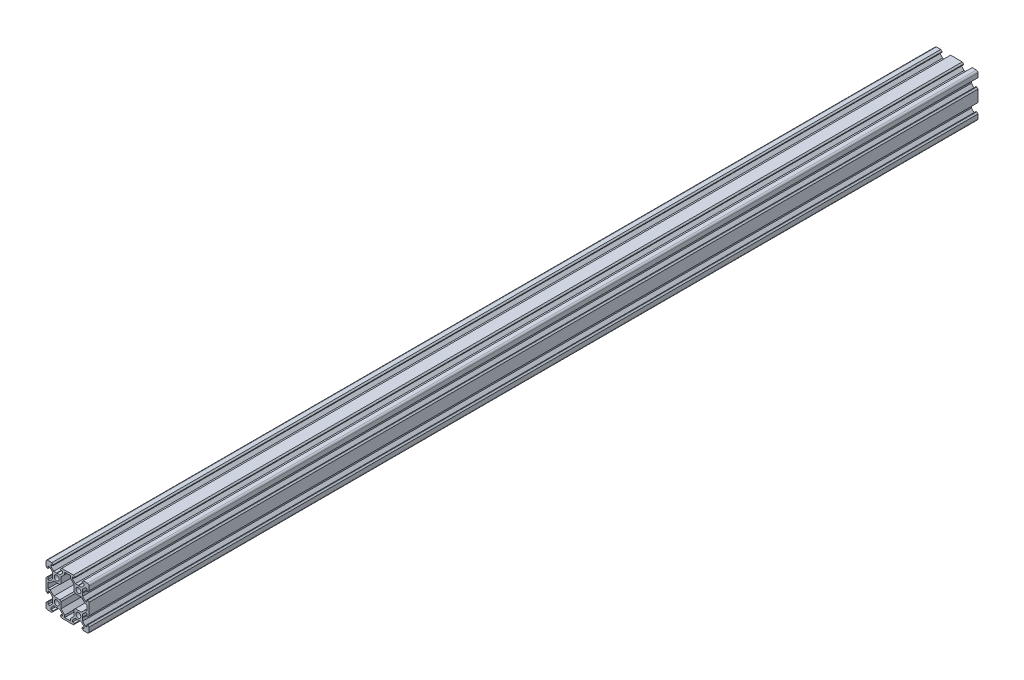
from build123d import *

# Parameters (mm, degrees)
SKETCH1_R           = 2.3
BOSS_EXTRUDE1_DEPTH = 825


with BuildPart() as part:
    # Sketch1 → Boss-Extrude1 (new body)
    with BuildSketch(Plane.XY):
        with BuildLine():
            Line((14.58, -20), (18.5, -20))
            ThreePointArc((18.5, -20), (19.560660172, -19.560660172), (20, -18.5))
            Line((20, -18.5), (20, -14.58))
            Line((20, -14.58), (18.815, -13.395))
            Line((18.815, -13.395), (18.2, -13.395))
            Line((18.2, -13.395), (18.2, -15.5))
            Line((18.2, -15.5), (16.560660172, -15.5))
            Line((16.560660172, -15.5), (13.9, -12.839339828))
            Line((13.9, -12.839339828), (13.9, -10.21))
            Line((13.9, -10.21), (13.69, -10))
            Line((13.69, -10), (13.9, -9.79))
            Line((13.9, -9.79), (13.9, -7.160660172))
            Line((13.9, -7.160660172), (16.560660172, -4.5))
            Line((16.560660172, -4.5), (18.2, -4.5))
            Line((18.2, -4.5), (18.2, -6.605))
            Line((18.2, -6.605), (18.815, -6.605))
            Line((18.815, -6.605), (20, -5.42))
            Line((20, -5.42), (20, 5.42))
            Line((20, 5.42), (18.815, 6.605))
            Line((18.815, 6.605), (18.2, 6.605))
            Line((18.2, 6.605), (18.2, 4.5))
            Line((18.2, 4.5), (16.560660172, 4.5))
            Line((16.560660172, 4.5), (13.9, 7.160660172))
            Line((13.9, 7.160660172), (13.9, 9.79))
            Line((13.9, 9.79), (13.69, 10))
            Line((13.69, 10), (13.9, 10.21))
            Line((13.9, 10.21), (13.9, 12.839339828))
            Line((13.9, 12.839339828), (16.560660172, 15.5))
            Line((16.560660172, 15.5), (18.2, 15.5))
            Line((18.2, 15.5), (18.2, 13.395))
            Line((18.2, 13.395), (18.815, 13.395))
            Line((18.815, 13.395), (20, 14.58))
            Line((20, 14.58), (20, 18.5))
            ThreePointArc((20, 18.5), (19.560660172, 19.560660172), (18.5, 20))
            Line((18.5, 20), (14.58, 20))
            Line((14.58, 20), (13.395, 18.815))
            Line((13.395, 18.815), (13.395, 18.2))
            Line((13.395, 18.2), (15.5, 18.2))
            Line((15.5, 18.2), (15.5, 16.560660172))
            Line((15.5, 16.560660172), (12.839339828, 13.9))
            Line((12.839339828, 13.9), (10.21, 13.9))
            Line((10.21, 13.9), (10, 13.69))
            Line((10, 13.69), (9.79, 13.9))
            Line((9.79, 13.9), (7.160660172, 13.9))
            Line((7.160660172, 13.9), (4.5, 16.560660172))
            Line((4.5, 16.560660172), (4.5, 18.2))
            Line((4.5, 18.2), (6.605, 18.2))
            Line((6.605, 18.2), (6.605, 18.815))
            Line((6.605, 18.815), (5.42, 20))
            Line((5.42, 20), (-5.42, 20))
            Line((-5.42, 20), (-6.605, 18.815))
            Line((-6.605, 18.815), (-6.605, 18.2))
            Line((-6.605, 18.2), (-4.5, 18.2))
            Line((-4.5, 18.2), (-4.5, 16.560660172))
            Line((-4.5, 16.560660172), (-7.160660172, 13.9))
            Line((-7.160660172, 13.9), (-9.79, 13.9))
            Line((-9.79, 13.9), (-10, 13.69))
            Line((-10, 13.69), (-10.21, 13.9))
            Line((-10.21, 13.9), (-12.839339828, 13.9))
            Line((-12.839339828, 13.9), (-15.5, 16.560660172))
            Line((-15.5, 16.560660172), (-15.5, 18.2))
            Line((-15.5, 18.2), (-13.395, 18.2))
            Line((-13.395, 18.2), (-13.395, 18.815))
            Line((-13.395, 18.815), (-14.58, 20))
            Line((-14.58, 20), (-18.5, 20))
            ThreePointArc((-18.5, 20), (-19.560660172, 19.560660172), (-20, 18.5))
            Line((-20, 18.5), (-20, 14.58))
            Line((-20, 14.58), (-18.815, 13.395))
            Line((-18.815, 13.395), (-18.2, 13.395))
            Line((-18.2, 13.395), (-18.2, 15.5))
            Line((-18.2, 15.5), (-16.560660172, 15.5))
            Line((-16.560660172, 15.5), (-13.9, 12.839339828))
            Line((-13.9, 12.839339828), (-13.9, 10.21))
            Line((-13.9, 10.21), (-13.69, 10))
            Line((-13.69, 10), (-13.9, 9.79))
            Line((-13.9, 9.79), (-13.9, 7.160660172))
            Line((-13.9, 7.160660172), (-16.560660172, 4.5))
            Line((-16.560660172, 4.5), (-18.2, 4.5))
            Line((-18.2, 4.5), (-18.2, 6.605))
            Line((-18.2, 6.605), (-18.815, 6.605))
            Line((-18.815, 6.605), (-20, 5.42))
            Line((-20, 5.42), (-20, -5.42))
            Line((-20, -5.42), (-18.815, -6.605))
            Line((-18.815, -6.605), (-18.2, -6.605))
            Line((-18.2, -6.605), (-18.2, -4.5))
            Line((-18.2, -4.5), (-16.560660172, -4.5))
            Line((-16.560660172, -4.5), (-13.9, -7.160660172))
            Line((-13.9, -7.160660172), (-13.9, -9.79))
            Line((-13.9, -9.79), (-13.69, -10))
            Line((-13.69, -10), (-13.9, -10.21))
            Line((-13.9, -10.21), (-13.9, -12.839339828))
            Line((-13.9, -12.839339828), (-16.560660172, -15.5))
            Line((-16.560660172, -15.5), (-18.2, -15.5))
            Line((-18.2, -15.5), (-18.2, -13.395))
            Line((-18.2, -13.395), (-18.815, -13.395))
            Line((-18.815, -13.395), (-20, -14.58))
            Line((-20, -14.58), (-20, -18.5))
            ThreePointArc((-20, -18.5), (-19.560660172, -19.560660172), (-18.5, -20))
            Line((-18.5, -20), (-14.58, -20))
            Line((-14.58, -20), (-13.395, -18.815))
            Line((-13.395, -18.815), (-13.395, -18.2))
            Line((-13.395, -18.2), (-15.5, -18.2))
            Line((-15.5, -18.2), (-15.5, -16.560660172))
            Line((-15.5, -16.560660172), (-12.839339828, -13.9))
            Line((-12.839339828, -13.9), (-10.21, -13.9))
            Line((-10.21, -13.9), (-10, -13.69))
            Line((-10, -13.69), (-9.79, -13.9))
            Line((-9.79, -13.9), (-7.160660172, -13.9))
            Line((-7.160660172, -13.9), (-4.5, -16.560660172))
            Line((-4.5, -16.560660172), (-4.5, -18.2))
            Line((-4.5, -18.2), (-6.605, -18.2))
            Line((-6.605, -18.2), (-6.605, -18.815))
            Line((-6.605, -18.815), (-5.42, -20))
            Line((-5.42, -20), (5.42, -20))
            Line((5.42, -20), (6.605, -18.815))
            Line((6.605, -18.815), (6.605, -18.2))
            Line((6.605, -18.2), (4.5, -18.2))
            Line((4.5, -18.2), (4.5, -16.560660172))
            Line((4.5, -16.560660172), (7.160660172, -13.9))
            Line((7.160660172, -13.9), (9.79, -13.9))
            Line((9.79, -13.9), (10, -13.69))
            Line((10, -13.69), (10.21, -13.9))
            Line((10.21, -13.9), (12.839339828, -13.9))
            Line((12.839339828, -13.9), (15.5, -16.560660172))
            Line((15.5, -16.560660172), (15.5, -18.2))
            Line((15.5, -18.2), (13.395, -18.2))
            Line((13.395, -18.2), (13.395, -18.815))
            Line((13.395, -18.815), (14.58, -20))
        make_face()
        with Locations((-10, -10)):
            Circle(SKETCH1_R, mode=Mode.SUBTRACT)
        with Locations((10, -10)):
            Circle(SKETCH1_R, mode=Mode.SUBTRACT)
        Polygon((-16.239339828, -2.7), (-18.2, -2.7), (-18.2, 2.7), (-16.239339828, 2.7), (-12.839339828, 6.1), (-7.160660172, 6.1), (-6.1, 7.160660172), (-6.1, 12.839339828), (-2.7, 16.239339828), (-2.7, 18.2), (2.7, 18.2), (2.7, 16.239339828), (6.1, 12.839339828), (6.1, 7.160660172), (7.160660172, 6.1), (12.839339828, 6.1), (16.239339828, 2.7), (18.2, 2.7), (18.2, -2.7), (16.239339828, -2.7), (12.839339828, -6.1), (7.160660172, -6.1), (6.1, -7.160660172), (6.1, -12.839339828), (2.7, -16.239339828), (2.7, -18.2), (-2.7, -18.2), (-2.7, -16.239339828), (-6.1, -12.839339828), (-6.1, -7.160660172), (-7.160660172, -6.1), (-12.839339828, -6.1), align=None, mode=Mode.SUBTRACT)
        with Locations((-10, 10)):
            Circle(SKETCH1_R, mode=Mode.SUBTRACT)
        with Locations((10, 10)):
            Circle(SKETCH1_R, mode=Mode.SUBTRACT)
    extrude(amount=BOSS_EXTRUDE1_DEPTH)


solid = part.part
